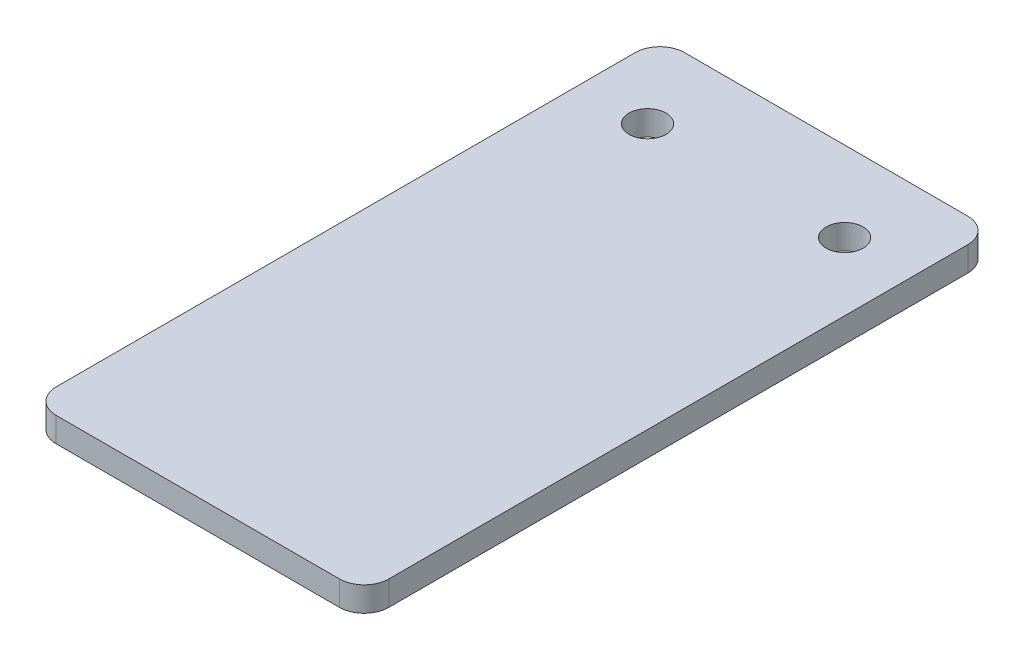
from build123d import *

# Parameters (mm, degrees)
SKETCH1_R           = 1.5
BOSS_EXTRUDE1_DEPTH = 2


with BuildPart() as part:
    # Sketch1 → Boss-Extrude1 (new body)
    with BuildSketch(Plane(origin=(0, 0, 0), x_dir=(1, 0, 0), z_dir=(0, 1, 0))):
        with BuildLine():
            Line((2, 0), (25, 0))
            ThreePointArc((25, 0), (26.414213562, 0.585786438), (27, 2))
            Line((27, 2), (27, 49))
            ThreePointArc((27, 49), (26.414213562, 50.414213562), (25, 51))
            Line((25, 51), (2, 51))
            ThreePointArc((2, 51), (0.585786438, 50.414213562), (0, 49))
            Line((0, 49), (0, 2))
            ThreePointArc((0, 2), (0.585786438, 0.585786438), (2, 0))
        make_face()
        with Locations(Location((21.5, 44.5, 0), (0, 0, 270))):
            Circle(SKETCH1_R, mode=Mode.SUBTRACT)
        with Locations(Location((5.5, 44.5, 0), (0, 0, 90))):
            Circle(SKETCH1_R, mode=Mode.SUBTRACT)
    extrude(amount=BOSS_EXTRUDE1_DEPTH)


solid = part.part
